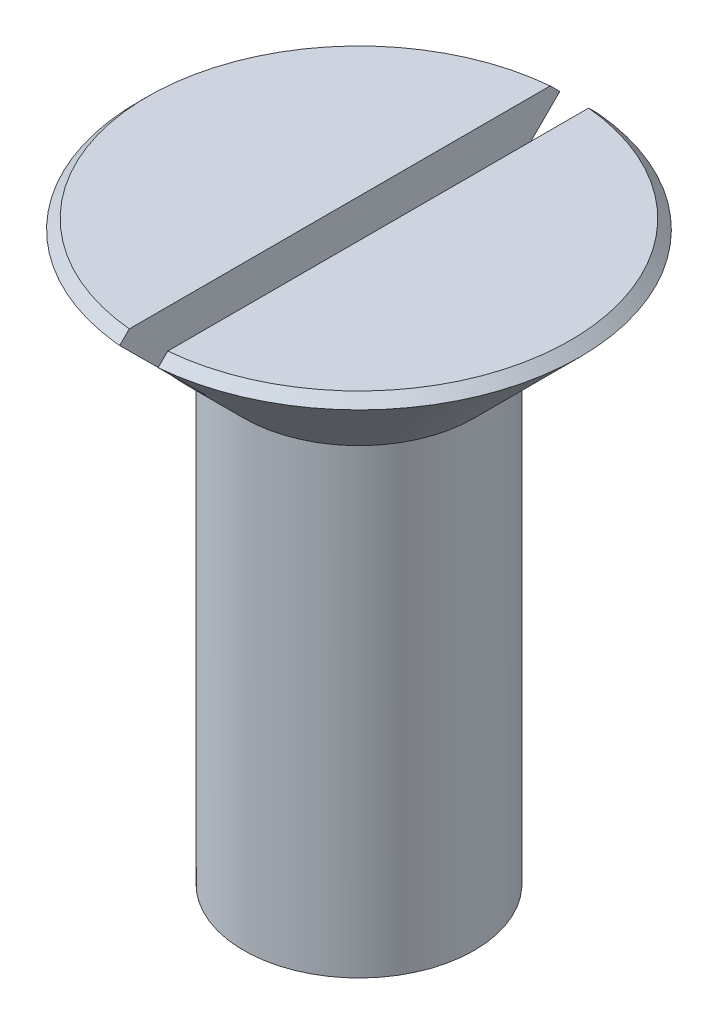
from build123d import *
from OCP.BRepFilletAPI import BRepFilletAPI_MakeChamfer

# Parameters (mm, degrees)
CUT_EXTRUDE1_DEPTH      = 35.467375879
CUT_EXTRUDE1_DEPTH_BACK = 35.467375879
SKETCH3_W               = 2
SKETCH3_H               = 3
CHAMFER1_SIZE           = 1
CHAMFER1_SIZE2          = 0.707106781


with BuildPart() as part:
    # Sketch2 → Revolve1 (revolve)
    with BuildSketch(Plane.XY):
        Polygon((0, 0), (0, 30), (12, 30), (6, 24), (6, 0), align=None)
    revolve(axis=Axis((0, 0, 0), (0, 1, 0)))

    # Sketch3 → Cut-Extrude1 (cut, two sides: drawn at the far end of the back side and taken through both)
    with BuildSketch(Plane.XY.offset(-CUT_EXTRUDE1_DEPTH_BACK)):
        with Locations((0, 28.5)):
            Rectangle(SKETCH3_W, SKETCH3_H)
    extrude(amount=CUT_EXTRUDE1_DEPTH + CUT_EXTRUDE1_DEPTH_BACK, mode=Mode.SUBTRACT)

    # Chamfer1: one chamfer whose edges measure the first distance from different faces: ONE call of the kernel's chamfer builder (chamfer() names one face for all edges)
    chamfer1_edges_1 = [part.edges().sort_by_distance(p)[0] for p in [
        (8.831760866, 30, -8.124038405),
    ]]
    chamfer1_side_1 = [part.faces().sort_by_distance(p)[0] for p in [
        (5.637458653, 30, 0),
    ]]
    chamfer1_edges_2 = [part.edges().sort_by_distance(p)[0] for p in [
        (-12, 30, 0),
    ]]
    chamfer1_side_2 = [part.faces().sort_by_distance(p)[0] for p in [
        (-5.637458653, 30, 0),
    ]]
    chamfer1 = BRepFilletAPI_MakeChamfer(part.part.solid().wrapped)
    for e in chamfer1_edges_1:
        chamfer1.Add(CHAMFER1_SIZE, CHAMFER1_SIZE2, e.wrapped, chamfer1_side_1[0].wrapped)  # the first distance lies on this face
    for e in chamfer1_edges_2:
        chamfer1.Add(CHAMFER1_SIZE, CHAMFER1_SIZE2, e.wrapped, chamfer1_side_2[0].wrapped)  # the first distance lies on this face
    add(Compound.cast(chamfer1.Shape()), mode=Mode.REPLACE)


solid = part.part
